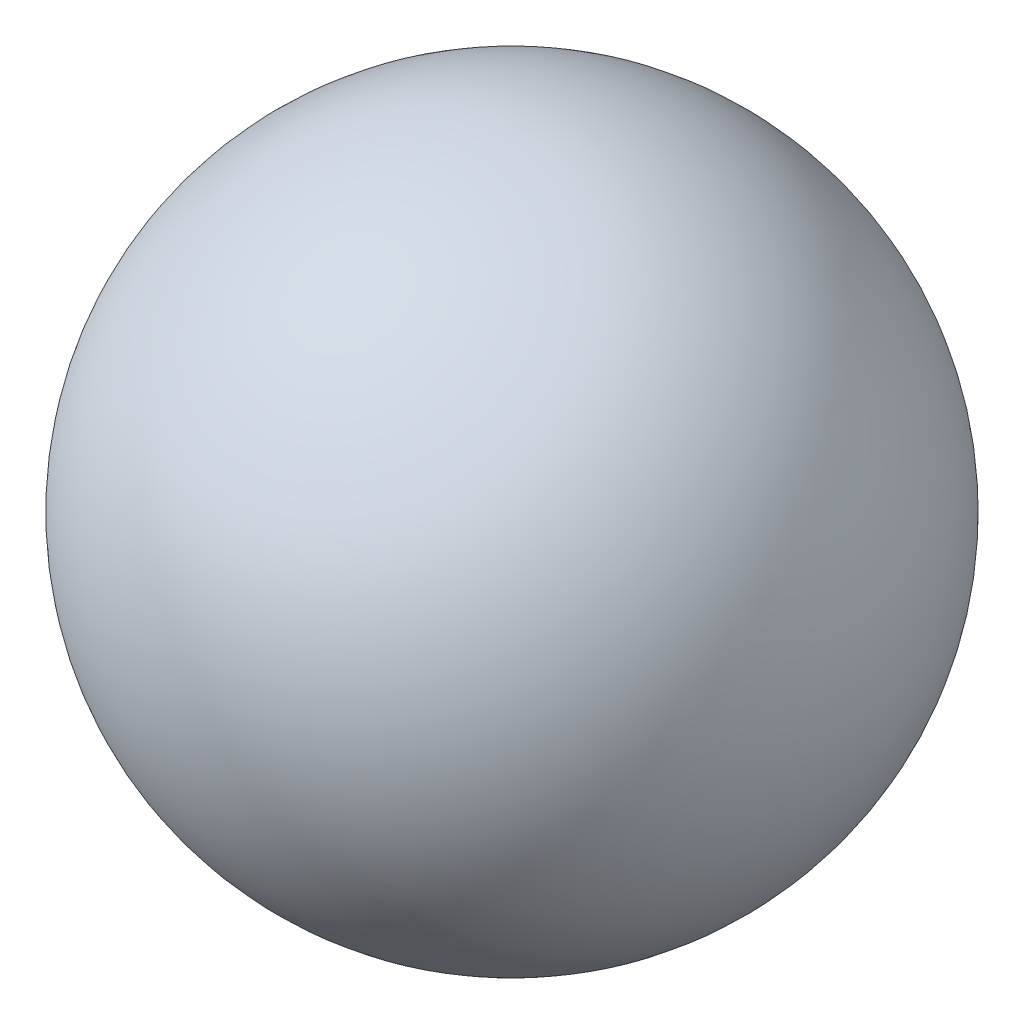
from build123d import *


with BuildPart() as part:
    # Croquis1 → Revolución1 (revolve)
    with BuildSketch(Plane.XY):
        with BuildLine():
            Line((0, 25.4), (0, 22.009690474))
            ThreePointArc((0, 22.009690474), (9.309690474, 12.7), (0, 3.390309526))
            Line((0, 3.390309526), (0, 0))
            ThreePointArc((0, 0), (12.7, 12.7), (0, 25.4))
        make_face()
    revolve(axis=Axis((0, 0, 0), (0, 1, 0)))


solid = part.part
